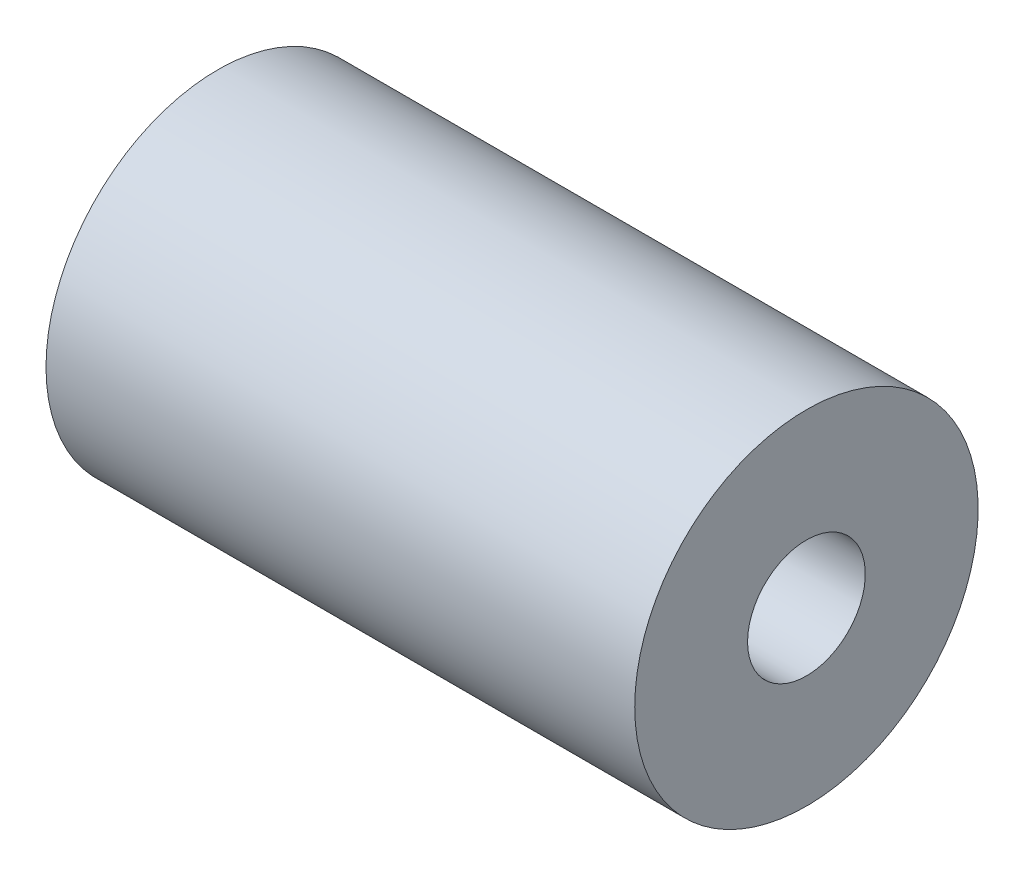
from build123d import *

# Parameters (mm, degrees)
AXIAL_PROFILE_MM_W = 24
AXIAL_PROFILE_MM_H = 4.6


with BuildPart() as part:
    # Axial profile (mm) → Full revolution (revolve)
    with BuildSketch(Plane.XY, mode=Mode.PRIVATE) as full_revolution_sk:
        with Locations((85, 4.7)):
            Rectangle(AXIAL_PROFILE_MM_W, AXIAL_PROFILE_MM_H)
    revolve(full_revolution_sk.sketch.rotate(Axis((-110, 0, 0), (1, 0, 0)), 90), axis=Axis((-110, 0, 0), (1, 0, 0)))


solid = part.part
